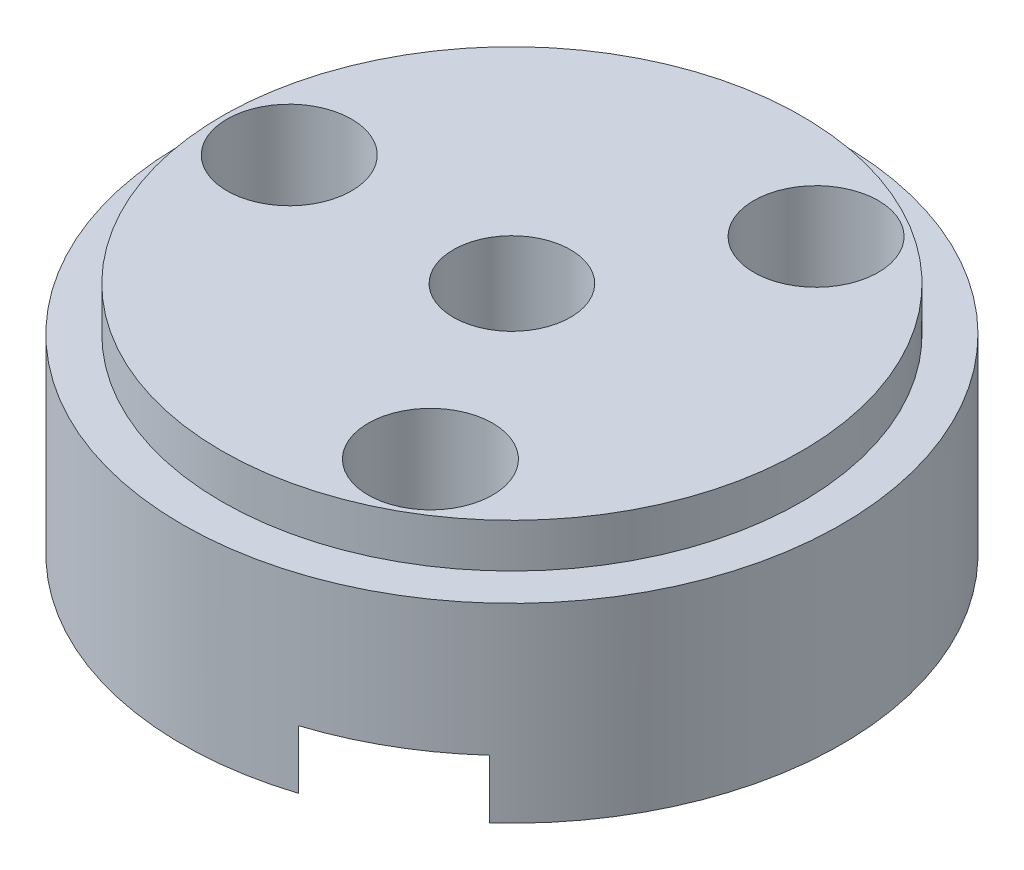
from build123d import *

# Parameters (mm, degrees)
SKETCH1_R           = 11.25
SKETCH1_R_2         = 2
BOSS_EXTRUDE1_DEPTH = 8
SKETCH2_R           = 2.125
CUT_EXTRUDE1_DEPTH  = 18.808003819
SKETCH3_R           = 4.15
CUT_EXTRUDE2_DEPTH  = 2
CUT_EXTRUDE3_START  = -1.5
SKETCH4_R           = 11.25
SKETCH4_R_2         = 9.9
CUT_EXTRUDE3_DEPTH  = 1.5


with BuildPart() as part:
    # Sketch1 → Boss-Extrude1 (new body)
    with BuildSketch(Plane(origin=(0, 0, 0), x_dir=(1, 0, 0), z_dir=(0, 1, 0))):
        with Locations(Location((0, 0, 0), (0, 0, 270))):
            Circle(SKETCH1_R)
        with Locations(Location((0, 0, 0), (0, 0, 270))):
            Circle(SKETCH1_R_2, mode=Mode.SUBTRACT)
    extrude(amount=BOSS_EXTRUDE1_DEPTH)

    # Sketch2 → Cut-Extrude1 (cut, through all)
    with BuildSketch(Plane.XZ):
        with Locations(Location((-7.6, 0, 0), (0, 0, 270))):
            Circle(SKETCH2_R)
        with Locations(Location((3.8, 6.581793069, 0), (0, 0, 270))):
            Circle(SKETCH2_R)
        with Locations(Location((3.8, -6.581793069, 0), (0, 0, 270))):
            Circle(SKETCH2_R)
    extrude(amount=-CUT_EXTRUDE1_DEPTH, mode=Mode.SUBTRACT)

    # Sketch3 → Cut-Extrude2 (cut)
    with BuildSketch(Plane.XZ):
        with Locations((-7.6, 0)):
            Circle(SKETCH3_R)
        with Locations((3.8, 6.581793069)):
            Circle(SKETCH3_R)
        with Locations((3.8, -6.581793069)):
            Circle(SKETCH3_R)
    extrude(amount=-CUT_EXTRUDE2_DEPTH, mode=Mode.SUBTRACT)

    # Sketch4 → Cut-Extrude3 (cut)
    with BuildSketch(Plane(origin=(0, 8, 0), x_dir=(1, 0, 0), z_dir=(0, 1, 0)).offset(CUT_EXTRUDE3_START)):
        with Locations(Location((0, 0, 0), (0, 0, 72.260290628))):
            Circle(SKETCH4_R)
        with Locations(Location((0, 0, 0), (0, 0, 270))):
            Circle(SKETCH4_R_2, mode=Mode.SUBTRACT)
    extrude(amount=CUT_EXTRUDE3_DEPTH, mode=Mode.SUBTRACT)


solid = part.part
